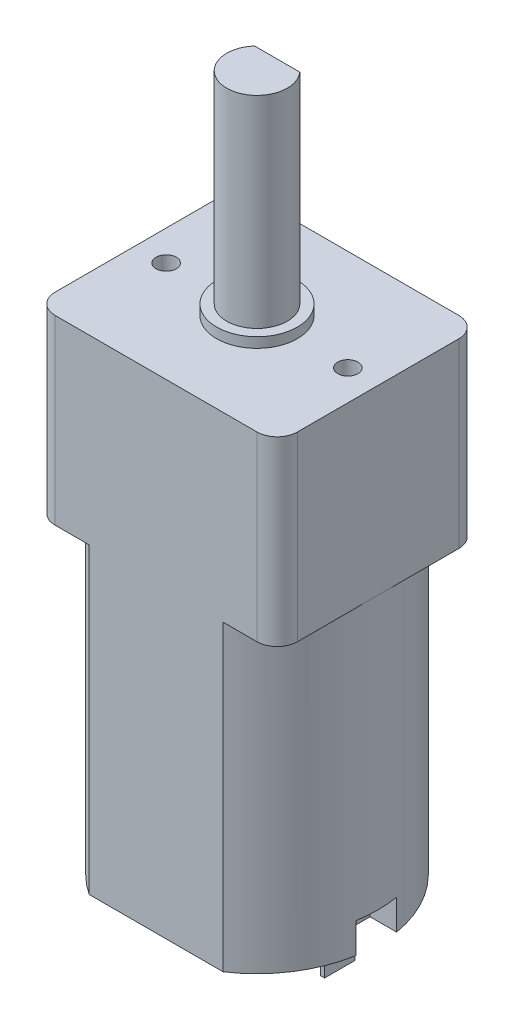
from build123d import *

# Parameters (mm, degrees)
BOSS_EXTRUDE1_DEPTH = 15
SKETCH2_R           = 2.5
BOSS_EXTRUDE2_DEPTH = 1.2
SKETCH3_W           = 0.2
SKETCH3_H           = 1.5
BOSS_EXTRUDE3_DEPTH = 2
SKETCH4_W           = 1.4
SKETCH4_H           = 2
CUT_EXTRUDE1_DEPTH  = 1.5
BOSS_EXTRUDE4_DEPTH = 9
BOSS_EXTRUDE5_DEPTH = 10.5
SKETCH7_R           = 2
BOSS_EXTRUDE6_DEPTH = 0.5
SKETCH8_R           = 0.5
CUT_EXTRUDE2_DEPTH  = 4.5


with BuildPart() as part:
    # Sketch1 → Boss-Extrude1 (new body)
    with BuildSketch(Plane(origin=(0, 0, 0), x_dir=(1, 0, 0), z_dir=(0, 1, 0))):
        with BuildLine():
            Line((-3.31662479, 5), (3.31662479, 5))
            ThreePointArc((3.31662479, 5), (6, 0), (3.31662479, -5))
            Line((3.31662479, -5), (-3.31662479, -5))
            ThreePointArc((-3.31662479, -5), (-6, 0), (-3.31662479, 5))
        make_face()
    extrude(amount=BOSS_EXTRUDE1_DEPTH)

    # Sketch2 → Boss-Extrude2 (add)
    with BuildSketch(Plane.XZ):
        with Locations(Location((0, 0, 0), (0, 0, 270))):
            Circle(SKETCH2_R)
    extrude(amount=BOSS_EXTRUDE2_DEPTH)

    # Sketch3 → Boss-Extrude3 (add)
    with BuildSketch(Plane.XZ):
        with Locations((4, 0)):
            Rectangle(SKETCH3_W, SKETCH3_H)
        with Locations((-4, 0)):
            Rectangle(SKETCH3_W, SKETCH3_H)
    extrude(amount=BOSS_EXTRUDE3_DEPTH)

    # Sketch4 → Cut-Extrude1 (cut)
    with BuildSketch(Plane.XZ):
        with Locations((-5.3, 0)):
            Rectangle(SKETCH4_W, SKETCH4_H)
        with Locations((5.3, 0)):
            Rectangle(SKETCH4_W, SKETCH4_H)
    extrude(amount=-CUT_EXTRUDE1_DEPTH, mode=Mode.SUBTRACT)

    # Sketch5 → Boss-Extrude4 (add)
    with BuildSketch(Plane(origin=(0, 15, 0), x_dir=(1, 0, 0), z_dir=(0, 1, 0))):
        with BuildLine():
            Line((-5, 5), (5, 5))
            ThreePointArc((5, 5), (5.707106781, 4.707106781), (6, 4))
            Line((6, 4), (6, -4))
            ThreePointArc((6, -4), (5.707106781, -4.707106781), (5, -5))
            Line((5, -5), (-5, -5))
            ThreePointArc((-5, -5), (-5.707106781, -4.707106781), (-6, -4))
            Line((-6, -4), (-6, 4))
            ThreePointArc((-6, 4), (-5.707106781, 4.707106781), (-5, 5))
        make_face()
    extrude(amount=BOSS_EXTRUDE4_DEPTH)

    # Sketch6 → Boss-Extrude5 (add)
    with BuildSketch(Plane(origin=(0, 24, 0), x_dir=(1, 0, 0), z_dir=(0, 1, 0))):
        with BuildLine():
            Line((-1.118033989, 1), (1.118033989, 1))
            ThreePointArc((1.118033989, 1), (0, -1.5), (-1.118033989, 1))
        make_face()
    extrude(amount=BOSS_EXTRUDE5_DEPTH)

    # Sketch7 → Boss-Extrude6 (add)
    with BuildSketch(Plane(origin=(0, 24, 0), x_dir=(1, 0, 0), z_dir=(0, 1, 0))):
        with Locations(Location((0, 0, 0), (0, 0, 90))):
            Circle(SKETCH7_R)
    extrude(amount=BOSS_EXTRUDE6_DEPTH)

    # Sketch8 → Cut-Extrude2 (cut)
    with BuildSketch(Plane(origin=(0, 24, 0), x_dir=(1, 0, 0), z_dir=(0, 1, 0))):
        with Locations(Location((-4.5, 0, 0), (0, 0, 270))):
            Circle(SKETCH8_R)
        with Locations(Location((4.5, 0, 0), (0, 0, 90))):
            Circle(SKETCH8_R)
    extrude(amount=-CUT_EXTRUDE2_DEPTH, mode=Mode.SUBTRACT)


solid = part.part
